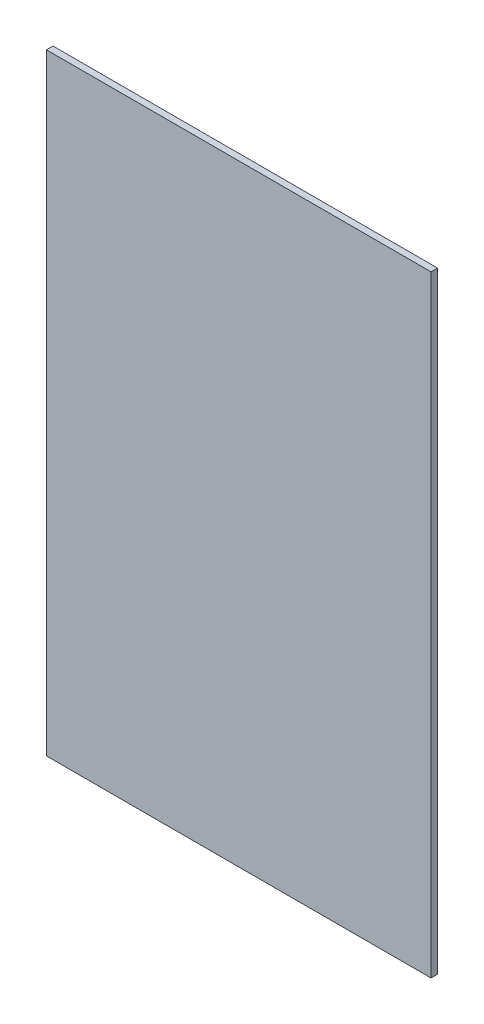
from build123d import *

# Parameters (mm, degrees)
SKETCH1_W           = 149.111686737
SKETCH1_H           = 237.0836
BOSS_EXTRUDE1_DEPTH = 2.54


with BuildPart() as part:
    # Sketch1 → Boss-Extrude1 (new body)
    with BuildSketch(Plane.XY):
        with Locations((-25.343343369, -179.324)):
            Rectangle(SKETCH1_W, SKETCH1_H)
    extrude(amount=BOSS_EXTRUDE1_DEPTH)


solid = part.part
